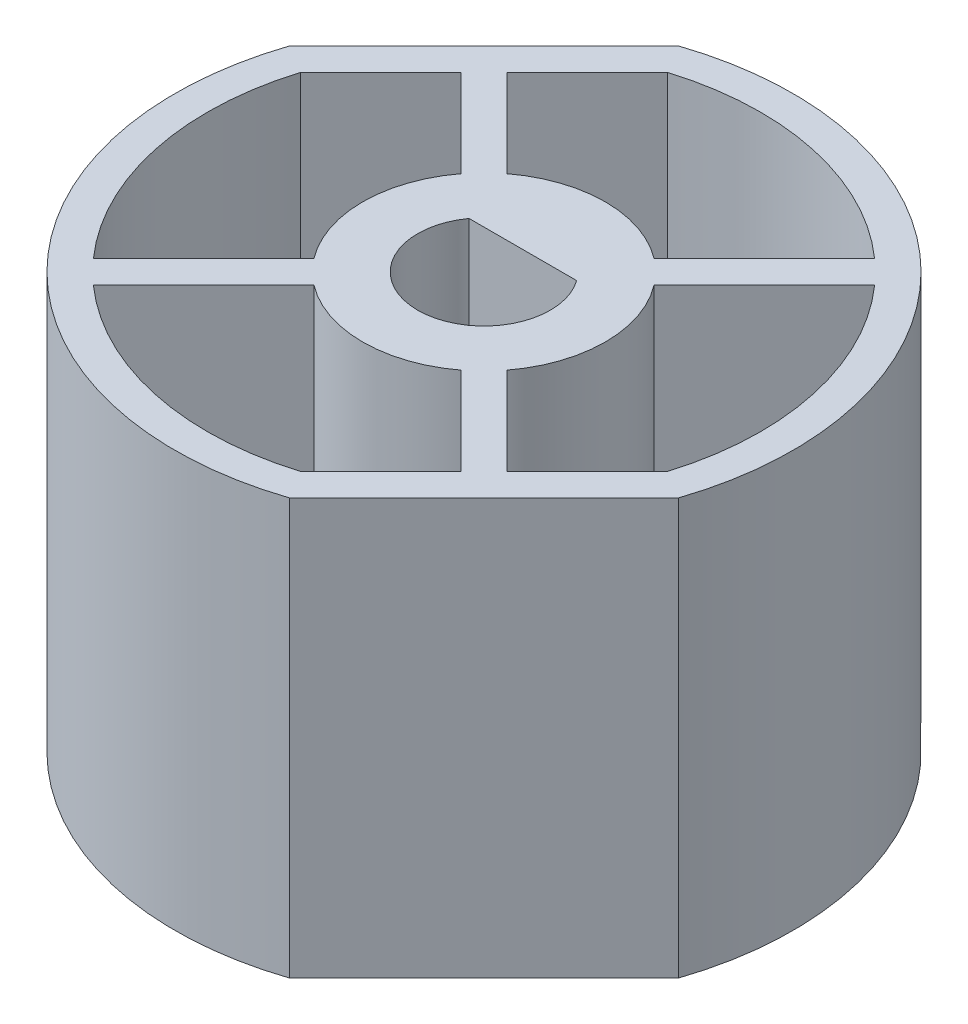
from build123d import *

# Parameters (mm, degrees)
SKETCH_1_R          = 19.1
EXTRUDE_1_DEPTH     = 25.7
SKETCH_1_7_R        = 2
CUT_EXTRUDE_1_DEPTH = 2
CUT_EXTRUDE_2_DEPTH = 38.28417895
CUT_EXTRUDE_3_DEPTH = 21.7
EXTRUDE_START       = 4
SKETCH_1_8_R        = 7.5
EXTRUDE_2_DEPTH     = 21.7
EXTRUDE_3_DEPTH     = 21.7


with BuildPart() as part:
    # 草图1 → 凸台-拉伸1 (new body)
    with BuildSketch(Plane(origin=(0, 0, 0), x_dir=(1, 0, 0), z_dir=(0, 1, 0))):
        with Locations(Location((0, 0, 0), (0, 0, 90))):
            Circle(SKETCH_1_R)
    extrude(amount=EXTRUDE_1_DEPTH)

    # 草图1<7> → 切除-拉伸1 (cut)
    with BuildSketch(Plane(origin=(0, 0, 0), x_dir=(1, 0, 0), z_dir=(0, 1, 0))):
        with Locations((3.535533906, 3.535533906)):
            Circle(SKETCH_1_7_R)
        Polygon((13.435028843, 14.849242405), (2.828427125, 4.242640687), (4.242640687, 2.828427125), (14.849242405, 13.435028843), align=None)
    extrude(amount=CUT_EXTRUDE_1_DEPTH, mode=Mode.SUBTRACT)

    # 草图2 → 切除-拉伸2 (cut, through all)
    with BuildSketch(Plane.XZ):
        with BuildLine():
            Line((12.091525958, 12.091525958), (18.108169541, 6.074882376))
            ThreePointArc((18.108169541, 6.074882376), (13.505739521, 13.505739521), (6.074882376, 18.108169541))
            Line((6.074882376, 18.108169541), (12.091525958, 12.091525958))
        make_face()
        with BuildLine():
            ThreePointArc((-18.108169541, -6.074882376), (-13.505739521, -13.505739521), (-6.074882376, -18.108169541))
            Line((-6.074882376, -18.108169541), (-12.091525958, -12.091525958))
            Line((-12.091525958, -12.091525958), (-18.108169541, -6.074882376))
        make_face()
    extrude(amount=-CUT_EXTRUDE_2_DEPTH, mode=Mode.SUBTRACT)

    # 草图3 → 切除-拉伸3 (cut)
    with BuildSketch(Plane(origin=(0, 25.7, 0), x_dir=(1, 0, 0), z_dir=(0, 1, 0))):
        with BuildLine():
            ThreePointArc((17.1, 0), (10.170102826, 13.74696361), (-5.002808012, 16.35181678))
            Line((-5.002808012, 16.35181678), (-16.35181678, 5.002808012))
            ThreePointArc((-16.35181678, 5.002808012), (-12.091525958, -12.091525958), (5.002808012, -16.35181678))
            Line((5.002808012, -16.35181678), (16.35181678, -5.002808012))
            ThreePointArc((16.35181678, -5.002808012), (16.911919863, -2.529222516), (17.1, 0))
        make_face()
    extrude(amount=-CUT_EXTRUDE_3_DEPTH, mode=Mode.SUBTRACT)

    # 草图1<8> → 凸台-拉伸2 (add)
    with BuildSketch(Plane(origin=(0, 0, 0), x_dir=(1, 0, 0), z_dir=(0, 1, 0)).offset(EXTRUDE_START)):
        with Locations(Location((0, 0, 0), (0, 0, 270))):
            Circle(SKETCH_1_8_R)
        with BuildLine():
            Line((-3.324154028, 2.4), (3.324154028, 2.4))
            ThreePointArc((3.324154028, 2.4), (0, -4.1), (-3.324154028, 2.4))
        make_face(mode=Mode.SUBTRACT)
    extrude(amount=EXTRUDE_2_DEPTH)

    # 草图4 → 拉伸-薄壁3 (add)
    with BuildSketch(Plane(origin=(0, 25.7, 0), x_dir=(1, 0, 0), z_dir=(0, 1, 0))):
        Polygon((-11.384419177, 9.970205615), (-4.313351365, 2.899137803), (-2.899137803, 4.313351365), (-9.970205615, 11.384419177), align=None)
        Polygon((11.384419177, 12.798632739), (3.606244584, 5.020458146), (5.020458146, 3.606244584), (12.798632739, 11.384419177), align=None)
        Polygon((-5.020458146, -3.606244584), (-12.798632739, -11.384419177), (-11.384419177, -12.798632739), (-3.606244584, -5.020458146), align=None)
        Polygon((2.899137803, -4.313351365), (9.970205615, -11.384419177), (11.384419177, -9.970205615), (4.313351365, -2.899137803), align=None)
    extrude(amount=-EXTRUDE_3_DEPTH)


solid = part.part
